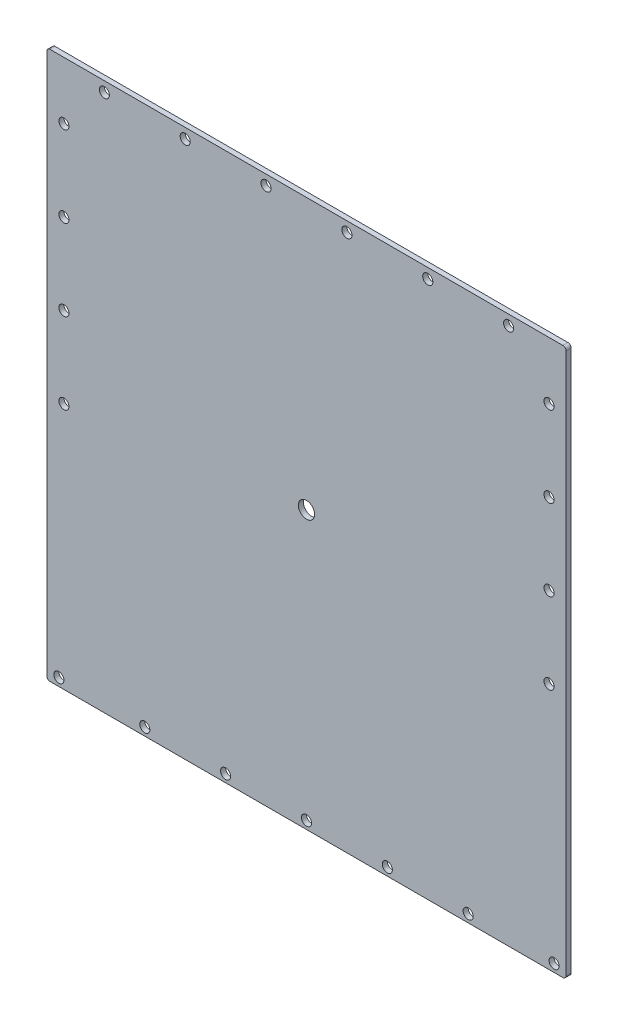
from build123d import *

# Parameters (mm, degrees)
SKETCH2_W           = 163.1
SKETCH2_H           = 171.98
SKETCH2_R           = 2.5527
SKETCH2_R_2         = 1.5875
BOSS_EXTRUDE2_DEPTH = 1.5875
FILLET1_R           = 1


with BuildPart() as part:
    # Sketch2 → Boss-Extrude2 (new body)
    with BuildSketch(Plane.XY):
        with Locations((82.55, -85.99)):
            Rectangle(SKETCH2_W, SKETCH2_H)
        with Locations((82.55, -85)):
            Circle(SKETCH2_R, mode=Mode.SUBTRACT)
        with Locations((82.55, -169.48)):
            Circle(SKETCH2_R_2, mode=Mode.SUBTRACT)
        with Locations((4.7625, -169.48)):
            Circle(SKETCH2_R_2, mode=Mode.SUBTRACT)
        with Locations((31.75, -169.48)):
            Circle(SKETCH2_R_2, mode=Mode.SUBTRACT)
        with Locations((57.15, -169.48)):
            Circle(SKETCH2_R_2, mode=Mode.SUBTRACT)
        with Locations((6.35, -94.25)):
            Circle(SKETCH2_R_2, mode=Mode.SUBTRACT)
        with Locations((6.35, -68.85)):
            Circle(SKETCH2_R_2, mode=Mode.SUBTRACT)
        with Locations((6.35, -43.45)):
            Circle(SKETCH2_R_2, mode=Mode.SUBTRACT)
        with Locations((6.35, -18.05)):
            Circle(SKETCH2_R_2, mode=Mode.SUBTRACT)
        with Locations((19.05, -3.175)):
            Circle(SKETCH2_R_2, mode=Mode.SUBTRACT)
        with Locations((44.45, -3.175)):
            Circle(SKETCH2_R_2, mode=Mode.SUBTRACT)
        with Locations((69.85, -3.175)):
            Circle(SKETCH2_R_2, mode=Mode.SUBTRACT)
        with Locations((158.75, -43.45)):
            Circle(SKETCH2_R_2, mode=Mode.SUBTRACT)
        with Locations((158.75, -18.05)):
            Circle(SKETCH2_R_2, mode=Mode.SUBTRACT)
        with Locations((146.05, -3.175)):
            Circle(SKETCH2_R_2, mode=Mode.SUBTRACT)
        with Locations((107.95, -169.48)):
            Circle(SKETCH2_R_2, mode=Mode.SUBTRACT)
        with Locations((133.35, -169.48)):
            Circle(SKETCH2_R_2, mode=Mode.SUBTRACT)
        with Locations((160.3375, -169.48)):
            Circle(SKETCH2_R_2, mode=Mode.SUBTRACT)
        with Locations((158.75, -94.25)):
            Circle(SKETCH2_R_2, mode=Mode.SUBTRACT)
        with Locations((158.75, -68.85)):
            Circle(SKETCH2_R_2, mode=Mode.SUBTRACT)
        with Locations((95.25, -3.175)):
            Circle(SKETCH2_R_2, mode=Mode.SUBTRACT)
        with Locations((120.65, -3.175)):
            Circle(SKETCH2_R_2, mode=Mode.SUBTRACT)
    extrude(amount=BOSS_EXTRUDE2_DEPTH)

    # Fillet1
    fillet1_edges = [part.edges().sort_by_distance(p)[0] for p in [
        (1, -171.98, 0.79375),
        (1, 0, 0.79375),
        (164.1, 0, 0.79375),
        (164.1, -171.98, 0.79375),
    ]]
    fillet(fillet1_edges, radius=FILLET1_R)


solid = part.part
